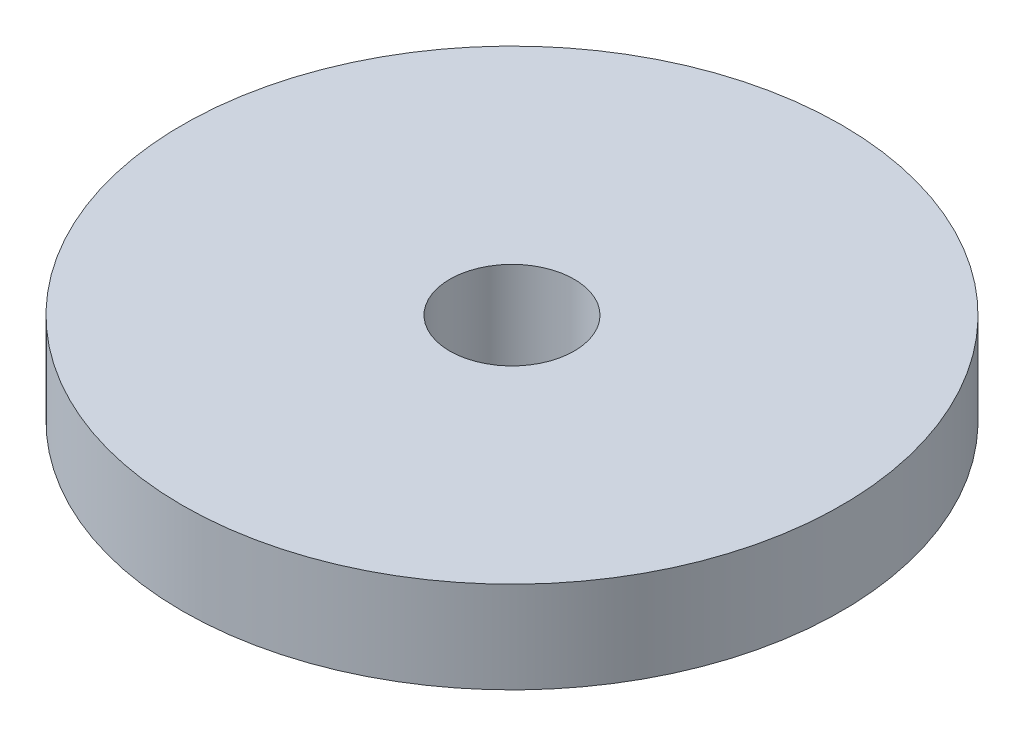
from build123d import *

# Parameters (mm, degrees)
SKETCH1_R           = 9
SKETCH1_R_2         = 1.7
BOSS_EXTRUDE1_DEPTH = 2.5


with BuildPart() as part:
    # Sketch1 → Boss-Extrude1 (new body)
    with BuildSketch(Plane(origin=(0, 0, 0), x_dir=(1, 0, 0), z_dir=(0, 1, 0))):
        with Locations(Location((0, 0, 0), (0, 0, 270))):
            Circle(SKETCH1_R)
        with Locations(Location((0, 0, 0), (0, 0, 270))):
            Circle(SKETCH1_R_2, mode=Mode.SUBTRACT)
    extrude(amount=BOSS_EXTRUDE1_DEPTH)


solid = part.part
